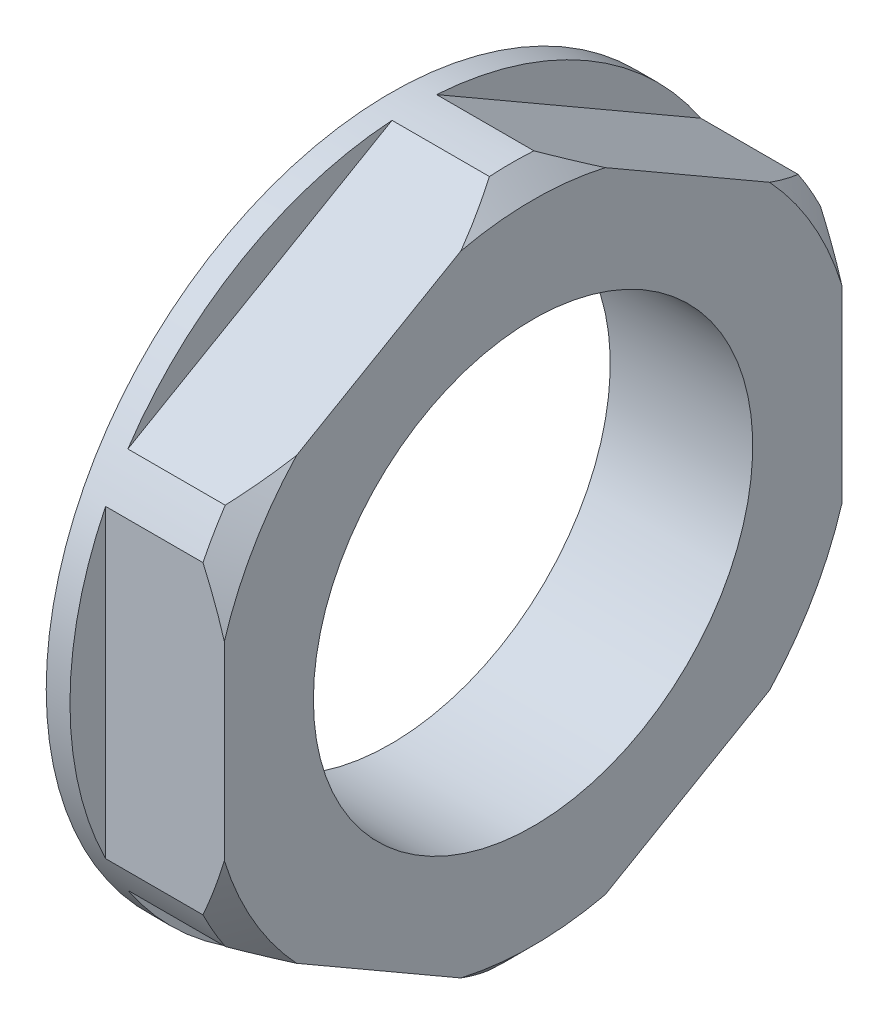
from build123d import *

# Parameters (mm, degrees)
EXTRUDE_1_DEPTH     = 6
SKETCH_3_R          = 14.5
EXTRUDE_2_DEPTH     = 1
SKETCH_4_R          = 15.011106999
SKETCH_4_R_2        = 14.5
CUT_EXTRUDE_1_DEPTH = 22.715969546
SKETCH_5_R          = 9.25
CUT_EXTRUDE_2_DEPTH = 22.365860619


with BuildPart() as part:
    # Эскиз1 → Вытянуть1 (new body)
    with BuildSketch(Plane(origin=(0, 0, 0), x_dir=(0, 0, -1), z_dir=(1, 0, 0))):
        Polygon((0, 15.011106999), (0, -15.011106999), (-13, -7.505553499), (-13, 7.505553499), align=None)
        Polygon((13, 7.505553499), (0, 15.011106999), (0, -15.011106999), (13, -7.505553499), align=None)
    extrude(amount=EXTRUDE_1_DEPTH)

    # Эскиз3 → Вытянуть2 (add)
    with BuildSketch(Plane.ZY):
        Circle(SKETCH_3_R)
    extrude(amount=-EXTRUDE_2_DEPTH)

    # Эскиз4 → Вырез-Вытянуть1 (cut, through all)
    with BuildSketch(Plane.ZY):
        Circle(SKETCH_4_R)
        Circle(SKETCH_4_R_2, mode=Mode.SUBTRACT)
    extrude(amount=-CUT_EXTRUDE_1_DEPTH, mode=Mode.SUBTRACT)

    # Эскиз5 → Вырез-Вытянуть2 (cut, through all)
    with BuildSketch(Plane.ZY):
        Circle(SKETCH_5_R)
    extrude(amount=-CUT_EXTRUDE_2_DEPTH, mode=Mode.SUBTRACT)

    # Эскиз6 → Вырез-Повернуть1 (revolve, cut)
    with BuildSketch(Plane.XY, mode=Mode.PRIVATE) as cut_revolve_1_sk:
        Polygon((4.5, 15.1), (6, 13.6), (6, 15.1), align=None)
    revolve(cut_revolve_1_sk.sketch.rotate(Axis((6, 0, 0), (-1, 0, 0)), 270), axis=Axis((6, 0, 0), (-1, 0, 0)), mode=Mode.SUBTRACT)


solid = part.part
